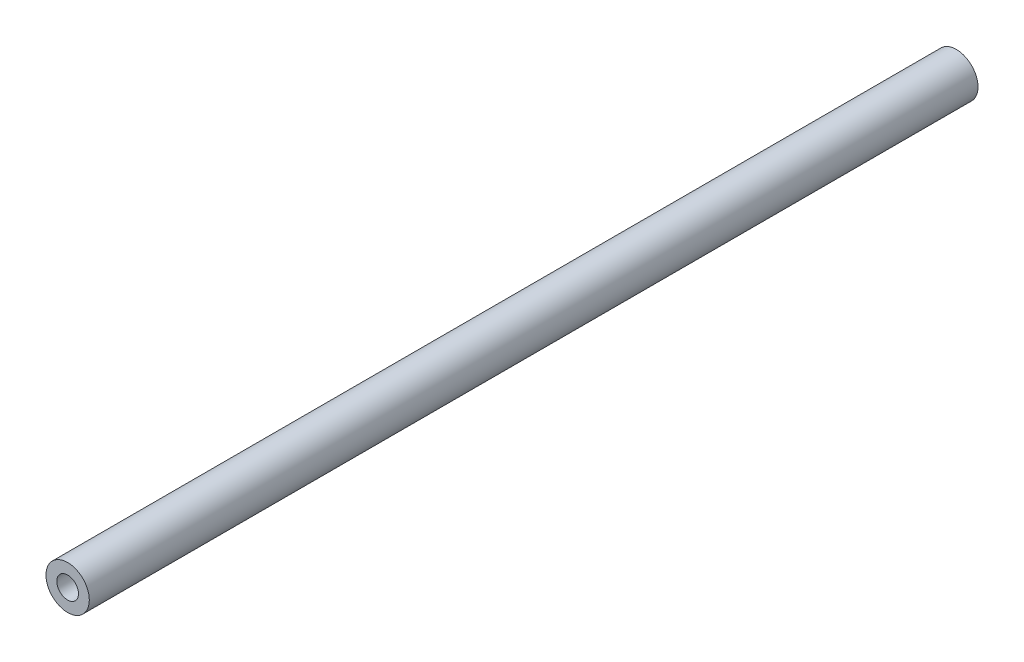
from build123d import *

# Parameters (mm, degrees)
SKICA1_R                = 2
SKICA1_R_2              = 1
P_IDAT_VYSUNUT_M1_DEPTH = 82


with BuildPart() as part:
    # Skica1 → Přidat vysunutím1 (new body)
    with BuildSketch(Plane.XY):
        Circle(SKICA1_R)
        Circle(SKICA1_R_2, mode=Mode.SUBTRACT)
    extrude(amount=P_IDAT_VYSUNUT_M1_DEPTH)


solid = part.part
